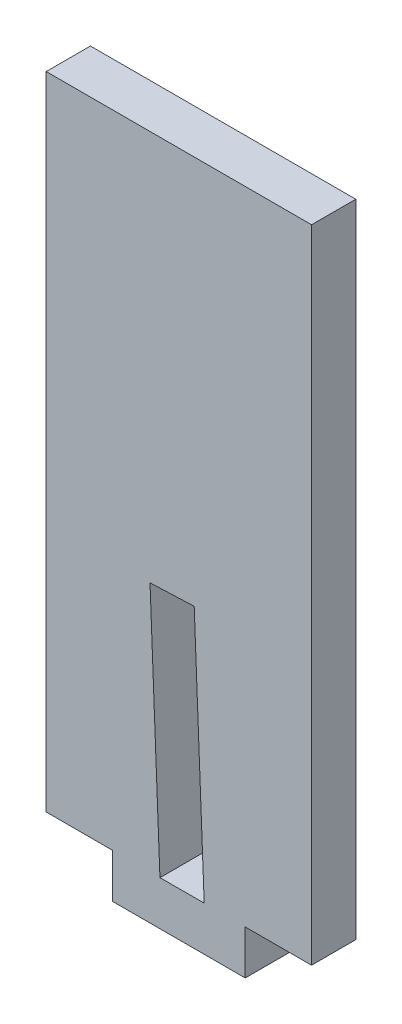
from build123d import *

# Parameters (mm, degrees)
EXTRUDE_1_DEPTH     = 2
SKETCH_3_W          = 12
SKETCH_3_H          = 1.078774048
CUT_EXTRUDE_2_DEPTH = 10
CUT_EXTRUDE_3_DEPTH = 2


with BuildPart() as part:
    # 草图1 → 凸台-拉伸1 (new body)
    with BuildSketch(Plane.XY):
        Polygon((-6, 0), (-6, 15), (-6, 30.078774409), (6, 30.078774409), (6, 15), (6, 0), (3, 0), (3, -2), (-3, -2), (-3, 0), align=None)
    extrude(amount=EXTRUDE_1_DEPTH)

    # 草图3 → 切除-拉伸2 (cut)
    with BuildSketch(Plane.XY.offset(2)):
        with Locations((0, 29.539387385)):
            Rectangle(SKETCH_3_W, SKETCH_3_H)
        Polygon((6, 29.000000361), (10.298878861, 29.000000361), (10.298878861, 34.143483695), (-9.585000786, 34.143483695), (-9.585000786, 29.000000361), (-6, 29.000000361), (-6, 30.078774409), (6, 30.078774409), align=None)
    extrude(amount=-CUT_EXTRUDE_2_DEPTH, mode=Mode.SUBTRACT)

    # 草图4 → 切除-拉伸3 (cut)
    with BuildSketch(Plane.XY.offset(2)):
        Polygon((1.144251734, 0.005791625), (-0.857088089, 0), (-1.291547484, 10.965059679), (-1.305754189, 11.323614176), (0.692677741, 11.402796374), align=None)
    extrude(amount=-CUT_EXTRUDE_3_DEPTH, mode=Mode.SUBTRACT)


solid = part.part
